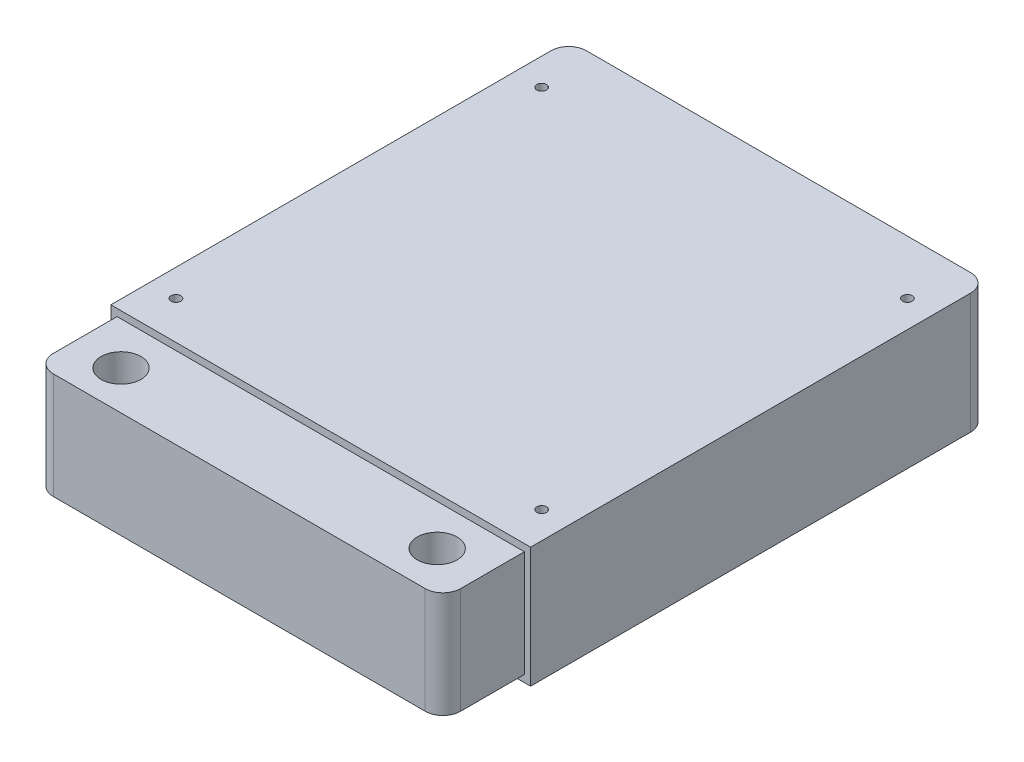
from build123d import *

# Parameters (mm, degrees)
SKETCH1_W           = 120.396
SKETCH1_H           = 131.318
BOSS_EXTRUDE1_DEPTH = 34.544
SKETCH2_R           = 1.397
CUT_EXTRUDE1_DEPTH  = 190.686741411
SKETCH3_W           = 116.84
SKETCH3_H           = 30.48
BOSS_EXTRUDE2_DEPTH = 23.368
SKETCH4_R           = 5.715
CUT_EXTRUDE2_DEPTH  = 190.327235429
FILLET1_R           = 5.08


with BuildPart() as part:
    # Sketch1 → Boss-Extrude1 (new body)
    with BuildSketch(Plane(origin=(0, 0, 0), x_dir=(1, 0, 0), z_dir=(0, 1, 0))):
        with Locations((-83.235647386, 53.565832685)):
            Rectangle(SKETCH1_W, SKETCH1_H)
    extrude(amount=BOSS_EXTRUDE1_DEPTH)

    # Sketch2 → Cut-Extrude1 (cut, through all)
    with BuildSketch(Plane(origin=(0, 34.544, 0), x_dir=(1, 0, 0), z_dir=(0, 1, 0))):
        with Locations(Location((-135.686647386, 103.730832685, 0), (0, 0, 270))):
            Circle(SKETCH2_R)
        with Locations(Location((-30.784647386, 103.730832685, 0), (0, 0, 270))):
            Circle(SKETCH2_R)
        with Locations(Location((-135.686647386, -1.171167315, 0), (0, 0, 270))):
            Circle(SKETCH2_R)
        with Locations(Location((-30.784647386, -1.171167315, 0), (0, 0, 270))):
            Circle(SKETCH2_R)
    extrude(amount=-CUT_EXTRUDE1_DEPTH, mode=Mode.SUBTRACT)

    # Sketch3 → Boss-Extrude2 (add)
    with BuildSketch(Plane.XY.offset(12.093167315)):
        with Locations((-83.235647386, 17.272)):
            Rectangle(SKETCH3_W, SKETCH3_H)
    extrude(amount=BOSS_EXTRUDE2_DEPTH)

    # Sketch4 → Cut-Extrude2 (cut, through all)
    with BuildSketch(Plane(origin=(0, 32.512, 0), x_dir=(1, 0, 0), z_dir=(0, 1, 0))):
        with Locations(Location((-128.320647386, -24.288198654, 0), (0, 0, 270))):
            Circle(SKETCH4_R)
        with Locations(Location((-38.150647386, -23.777167315, 0), (0, 0, 270))):
            Circle(SKETCH4_R)
    extrude(amount=-CUT_EXTRUDE2_DEPTH, mode=Mode.SUBTRACT)

    # Fillet1
    fillet1_edges = [part.edges().sort_by_distance(p)[0] for p in [
        (-24.815647386, 17.272, 35.461167315),
        (-141.655647386, 17.272, 35.461167315),
        (-143.433647386, 17.272, -119.224832685),
        (-23.037647386, 17.272, -119.224832685),
    ]]
    fillet(fillet1_edges, radius=FILLET1_R)


solid = part.part
